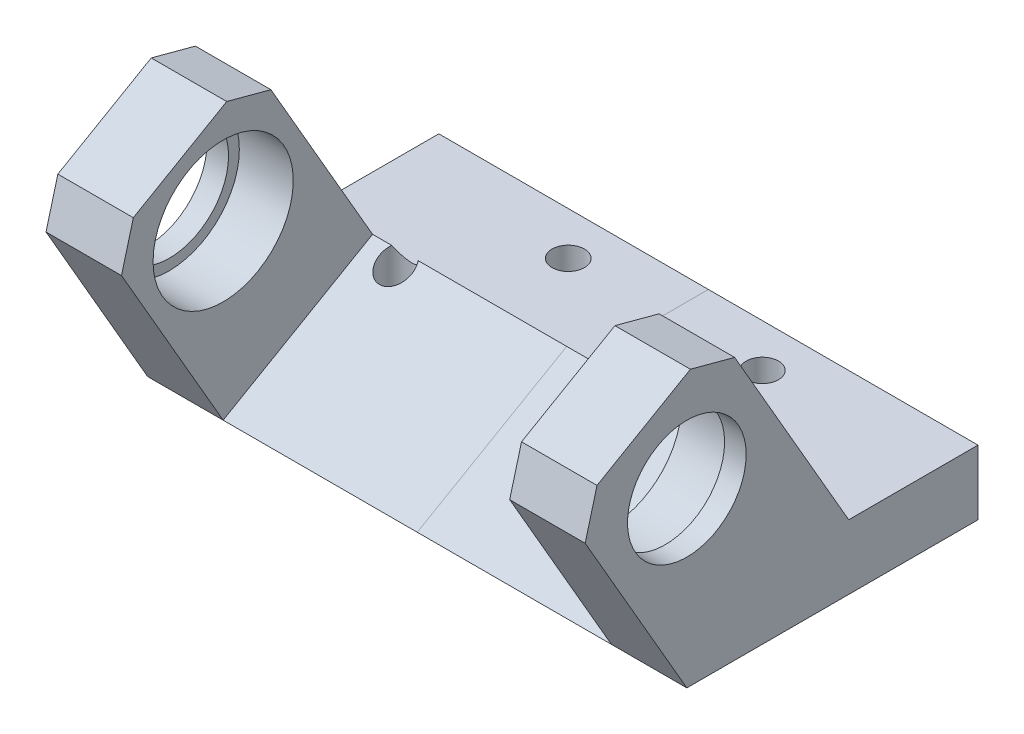
from build123d import *

# Parameters (mm, degrees)
SKETCH_1_R          = 6.5
EXTRUDE_1_DEPTH     = 25
CHAMFER_1_SIZE      = 3
CUT_EXTRUDE_START   = -21.856406
SKETCH_2_W          = 36
SKETCH_2_H          = 16
CUT_EXTRUDE_1_DEPTH = 21.856406
EXTRUDE_START       = -2
SKETCH_3_R          = 6.5
SKETCH_3_R_2        = 5.5
EXTRUDE_2_DEPTH     = 2
HOLE_WIZARD_M3_1_D  = 3


with BuildPart() as part:
    # 草图1 → 凸台-拉伸1 (new, symmetric)
    with BuildSketch(Plane(origin=(0, 0, 0), x_dir=(0, 0, -1), z_dir=(1, 0, 0))):
        Polygon((0, 0), (-10.92820323, 18.92820323), (2.92820323, 26.92820323), (15.011106999, 6), (27, 6), (27, 0), align=None)
        with Locations((0, 16)):
            Circle(SKETCH_1_R, mode=Mode.SUBTRACT)
    extrude(amount=EXTRUDE_1_DEPTH, both=True)

    # 倒角1
    chamfer_1_edges = [part.edges().sort_by_distance(p)[0] for p in [
        (0, 18.92820323, 10.92820323),
        (0, 26.92820323, -2.92820323),
    ]]
    chamfer(chamfer_1_edges, length=CHAMFER_1_SIZE)

    # 草图2 → 切除-拉伸1 (cut)
    with BuildSketch(Plane(origin=(0, 18.92820323, 10.92820323), x_dir=(1, 0, 0), z_dir=(0, 0.8660254037844396, 0.49999999999999845)).offset(CUT_EXTRUDE_START)):
        with Locations((0, 8)):
            Rectangle(SKETCH_2_W, SKETCH_2_H)
    extrude(amount=CUT_EXTRUDE_1_DEPTH, mode=Mode.SUBTRACT)

    # 草图3 → 凸台-拉伸2 (add)
    with BuildSketch(Plane(origin=(25, 0, 0), x_dir=(0, 0, -1), z_dir=(1, 0, 0)).offset(EXTRUDE_START)):
        with Locations((0, 16)):
            Circle(SKETCH_3_R)
        with Locations((0, 16)):
            Circle(SKETCH_3_R_2, mode=Mode.SUBTRACT)
    extrude_2 = extrude(amount=EXTRUDE_2_DEPTH)

    # 镜向1: 凸台-拉伸2 across plane
    add(extrude_2.mirror(Plane(origin=(0, 0, 0), x_dir=(0, 0, 1), z_dir=(1, 0, 0))))

    # M3 螺纹孔1 (through all)
    with Locations(Plane(origin=(0, 0, 0), x_dir=(-1, 0, 0), z_dir=(0, -1, 0))):
        with Locations((-15, 13), (-9, 23), (9, 23), (15, 13)):
            Hole(HOLE_WIZARD_M3_1_D / 2)


with BuildPart() as body_2:
    # Split Bodies 1: the piece on the far side of the plane
    add(part.part)
    split(bisect_by=Plane(origin=(0, 0, 0), x_dir=(0, 0, 1), z_dir=(1, 0, 0)), keep=Keep.BOTTOM)


with BuildPart() as part_1:
    add(part.part)

    # Split Bodies 1
    split(bisect_by=Plane(origin=(0, 0, 0), x_dir=(0, 0, 1), z_dir=(1, 0, 0)), keep=Keep.TOP)


solid = Compound([body_2.part, part_1.part])
